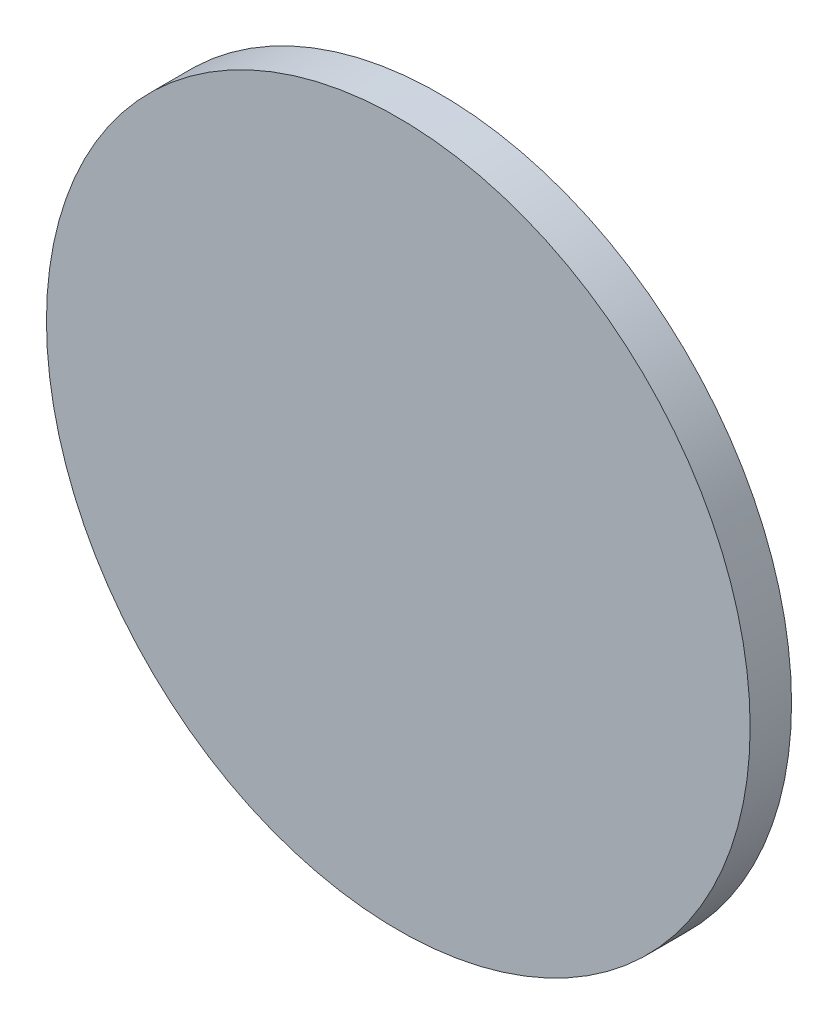
from build123d import *

# Parameters (mm, degrees)
SKETCH2_R           = 25.5
BOSS_EXTRUDE1_DEPTH = 3


with BuildPart() as part:
    # Sketch2 → Boss-Extrude1 (new body)
    with BuildSketch(Plane.XY):
        Circle(SKETCH2_R)
    extrude(amount=BOSS_EXTRUDE1_DEPTH)


solid = part.part
